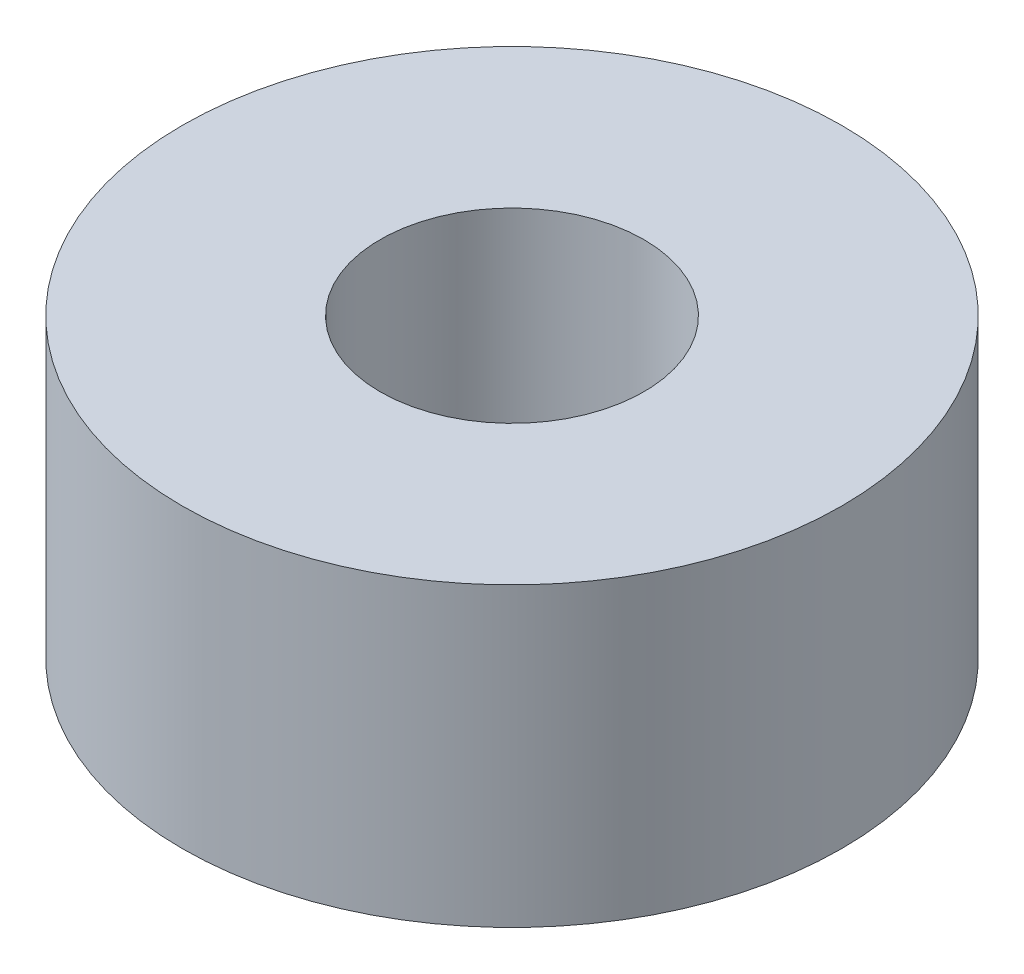
from build123d import *

# Parameters (mm, degrees)
SKETCH1_R           = 10
SKETCH1_R_2         = 4
BOSS_EXTRUDE1_DEPTH = 9


with BuildPart() as part:
    # Sketch1 → Boss-Extrude1 (new body)
    with BuildSketch(Plane(origin=(0, 0, 0), x_dir=(1, 0, 0), z_dir=(0, 1, 0))):
        with Locations(Location((0, 0, 0), (0, 0, 270))):
            Circle(SKETCH1_R)
        with Locations(Location((0, 0, 0), (0, 0, 270))):
            Circle(SKETCH1_R_2, mode=Mode.SUBTRACT)
    extrude(amount=BOSS_EXTRUDE1_DEPTH)


solid = part.part
